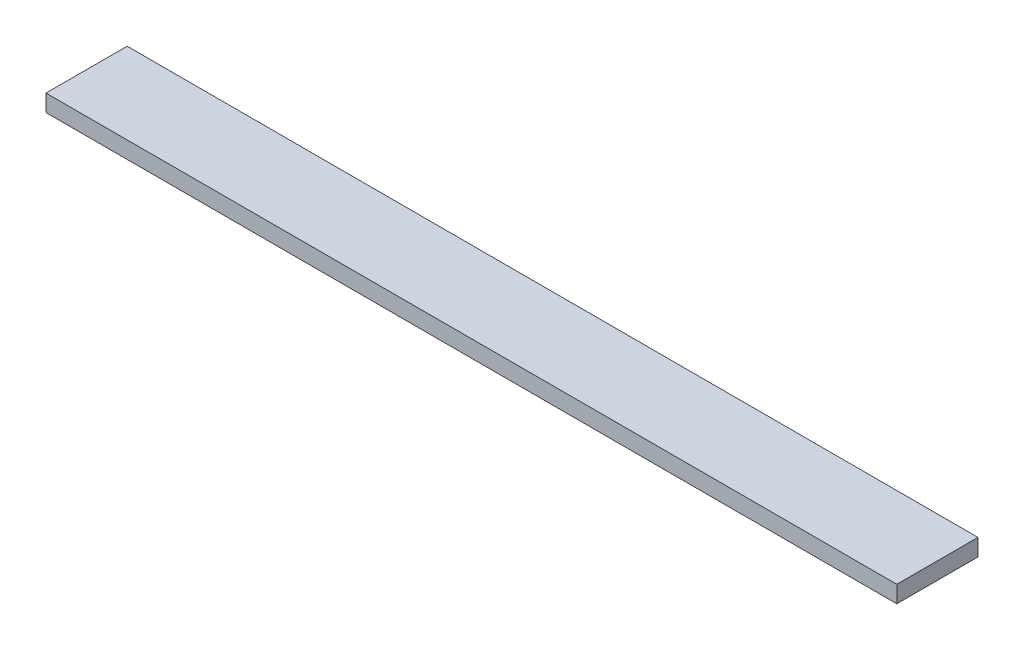
from build123d import *

# Parameters (mm, degrees)
SKETCH1_W           = 48
SKETCH1_H           = 10
BOSS_EXTRUDE1_DEPTH = 503


with BuildPart() as part:
    # Sketch1 → Boss-Extrude1 (new body)
    with BuildSketch(Plane(origin=(0, 0, 0), x_dir=(0, 0, -1), z_dir=(1, 0, 0))):
        with Locations((24, 5)):
            Rectangle(SKETCH1_W, SKETCH1_H)
    extrude(amount=BOSS_EXTRUDE1_DEPTH)


solid = part.part
